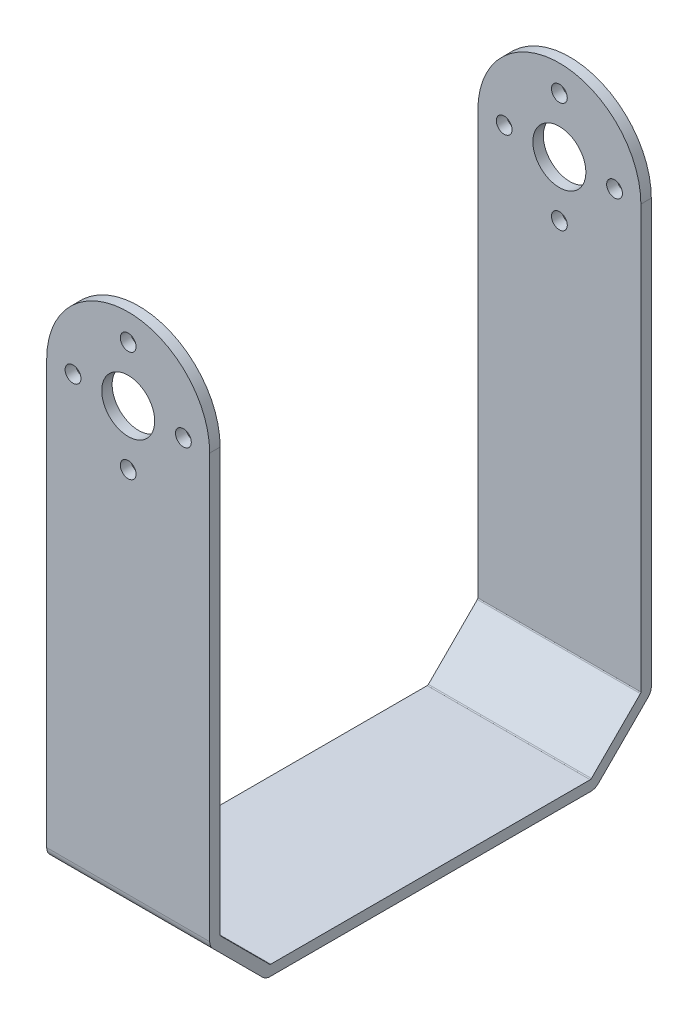
from build123d import *

# Parameters (mm, degrees)
SKETCH2_W         = 66.675
SKETCH2_H         = 85.3186
EXTRUDE1_DEPTH    = 24.6126
SKETCH3_OUTSIDE_W = 90.883
SKETCH3_OUTSIDE_H = 109.527
EXTRUDE2_DEPTH    = 24.6126
SKETCH4_OUTSIDE_W = 48.821
SKETCH4_OUTSIDE_H = 109.527
EXTRUDE3_DEPTH    = 112.043231265
FILLET1_R         = 1.5875
FILLET2_R         = 0.254
SKETCH5_R         = 4.0005
SKETCH5_R_2       = 1.1938
EXTRUDE4_DEPTH    = 112.043231265


with BuildPart() as part:
    # Sketch2 → Extrude1 (new body)
    with BuildSketch(Plane(origin=(0, 0, 0), x_dir=(0, 0, -1), z_dir=(1, 0, 0))):
        with Locations((33.3375, 42.6593)):
            Rectangle(SKETCH2_W, SKETCH2_H)
    extrude(amount=EXTRUDE1_DEPTH)

    # Sketch3 outside → Extrude2 (cut)
    with BuildSketch(Plane(origin=(24.6126, 0, 0), x_dir=(0, 0, -1), z_dir=(1, 0, 0))):
        with Locations((33.3375, 42.6595)):
            Rectangle(SKETCH3_OUTSIDE_W, SKETCH3_OUTSIDE_H)
        Polygon((1.5748, 85.3186), (1.5748, 9.1186), (9.1186, 1.5748), (57.5564, 1.5748), (65.1002, 9.1186), (65.1002, 85.3186), (66.675, 85.3186), (66.675, 8.466296482), (58.208703518, 0), (8.466296482, 0), (0, 8.466296482), (0, 85.3186), align=None, mode=Mode.SUBTRACT)
    extrude(amount=-EXTRUDE2_DEPTH, mode=Mode.SUBTRACT)

    # Sketch4 outside → Extrude3 (cut, through all)
    with BuildSketch(Plane.XY):
        with Locations((12.3065, 42.6595)):
            Rectangle(SKETCH4_OUTSIDE_W, SKETCH4_OUTSIDE_H)
        with BuildLine():
            Line((0, 73.0123), (0, 0))
            Line((0, 0), (24.6126, 0))
            Line((24.6126, 0), (24.6126, 73.0123))
            ThreePointArc((24.6126, 73.0123), (12.3063, 85.3186), (0, 73.0123))
        make_face(mode=Mode.SUBTRACT)
    extrude(amount=-EXTRUDE3_DEPTH, mode=Mode.SUBTRACT)

    # Fillet1
    fillet1_edges = [part.edges().sort_by_distance(p)[0] for p in [
        (12.3063, 8.466296482, -66.675),
        (12.3063, 0, -58.208703518),
        (12.3063, 0, -8.466296482),
        (12.3063, 8.466296482, 0),
    ]]
    fillet(fillet1_edges, radius=FILLET1_R)

    # Fillet2
    fillet2_edges = [part.edges().sort_by_distance(p)[0] for p in [
        (12.3063, 9.1186, -1.5748),
        (12.3063, 1.5748, -9.1186),
        (12.3063, 1.5748, -57.5564),
        (12.3063, 9.1186, -65.1002),
    ]]
    fillet(fillet2_edges, radius=FILLET2_R)

    # Sketch5 → Extrude4 (cut, through all)
    with BuildSketch(Plane.XY):
        with Locations((12.3063, 73.025)):
            Circle(SKETCH5_R)
        with Locations((12.3063, 81.3562)):
            Circle(SKETCH5_R_2)
        with Locations((3.9751, 73.025)):
            Circle(SKETCH5_R_2)
        with Locations((12.3063, 64.6938)):
            Circle(SKETCH5_R_2)
        with Locations((20.6375, 73.025)):
            Circle(SKETCH5_R_2)
    extrude(amount=-EXTRUDE4_DEPTH, mode=Mode.SUBTRACT)


solid = part.part
